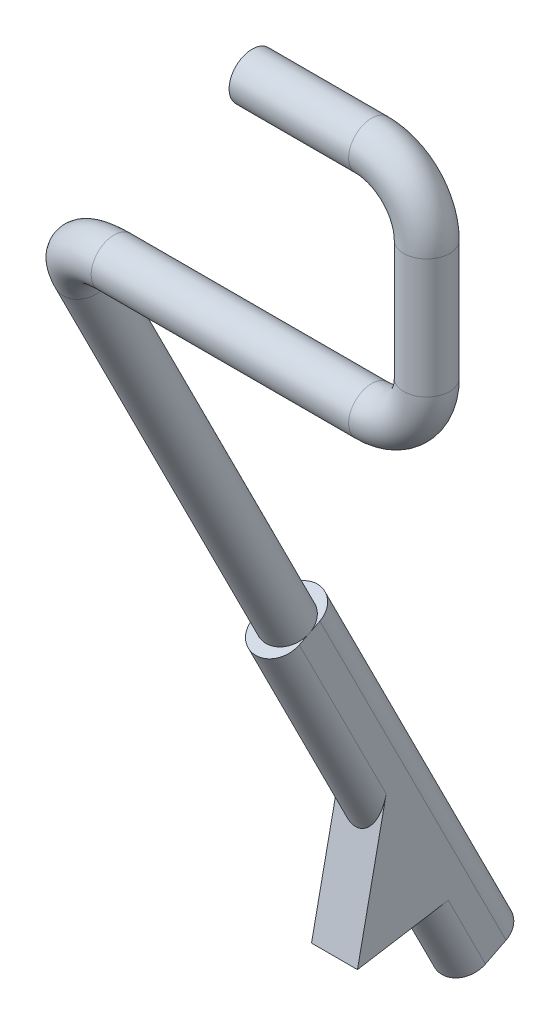
from build123d import *

# Parameters (mm, degrees)
SKETCH2_R           = 2.5
BOSS_EXTRUDE1_DEPTH = 45
BOSS_EXTRUDE2_DEPTH = 5


with BuildPart() as part:
    # Sweep1: sweep along a curve in space
    with BuildLine() as sweep1_path:
        Line((-40, -30.35817133, -2.7), (-40, -114.302855497, -45))
        ThreePointArc((-34, -25, 0), (-38.242640687, -26.569372048, -0.790811691), (-40, -30.35817133, -2.7))
        Line((-6, -25, 0), (-34, -25, 0))
        ThreePointArc((-6, -25, 0), (-1.757359313, -23.242640687, 0), (0, -19, 0))
        Line((0, -6, 0), (0, -19, 0))
        ThreePointArc((-6, 0, 0), (-1.757359313, -1.757359313, 0), (0, -6, 0))
        Line((-6, 0, 0), (-19, 0, 0))
    # Sketch2 → Sweep1 (sweep)
    with BuildSketch(Plane(origin=(-19, 0, 0), x_dir=(0, 0, -1), z_dir=(1, 0, 0))):
        Circle(SKETCH2_R)
    sweep(path=sweep1_path.line)

    # Sketch3 → Boss-Extrude1 (add)
    with BuildSketch(Plane(origin=(0, -109.240355497, -55.046571243), x_dir=(1, 0, 0), z_dir=(0, -0.8930285549745877, -0.45000000000000007))):
        with BuildLine():
            Line((-37.5, 11.25), (-37.5, 12.5))
            ThreePointArc((-37.5, 12.5), (-40, 15), (-42.5, 12.5))
            Line((-42.5, 12.5), (-42.5, 11.25))
            ThreePointArc((-42.5, 11.25), (-40, 13.75), (-37.5, 11.25))
        make_face()
        with BuildLine():
            ThreePointArc((-42.5, 11.25), (-40, 8.75), (-37.5, 11.25))
            ThreePointArc((-37.5, 11.25), (-40, 13.75), (-42.5, 11.25))
        make_face()
        with BuildLine():
            Line((-37.5, 10), (-37.5, 11.25))
            ThreePointArc((-37.5, 11.25), (-40, 8.75), (-42.5, 11.25))
            Line((-42.5, 11.25), (-42.5, 10))
            ThreePointArc((-42.5, 10), (-40, 7.5), (-37.5, 10))
        make_face()
    extrude(amount=-BOSS_EXTRUDE1_DEPTH)

    # Sketch4 → Boss-Extrude2 (add)
    with BuildSketch(Plane.ZY.offset(42.5)):
        Polygon((-39.833714306, -106.828098503), (-29.963286264, -108.432670178), (-33.083714306, -93.432670178), align=None)
    extrude(amount=-BOSS_EXTRUDE2_DEPTH)


solid = part.part
